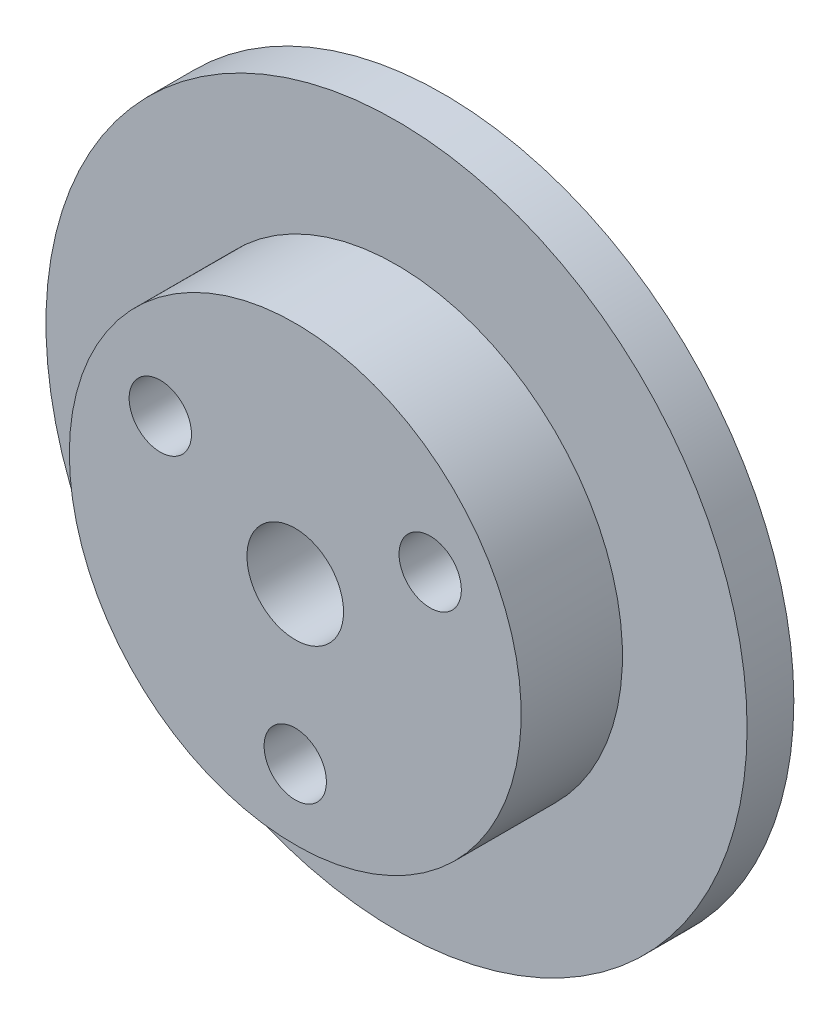
from build123d import *

# Parameters (mm, degrees)
ESQUISSE1_R             = 22.5
BOSS_EXTRU_1_DEPTH      = 3
ESQUISSE2_R             = 14.5
BOSS_EXTRU_2_DEPTH      = 6.5
ESQUISSE3_R             = 2
ESQUISSE3_R_2           = 3.1
ENL_V_MAT_EXTRU_1_DEPTH = 34.207679835


with BuildPart() as part:
    # Esquisse1 → Boss.-Extru.1 (new body)
    with BuildSketch(Plane.XY):
        Circle(ESQUISSE1_R)
    extrude(amount=BOSS_EXTRU_1_DEPTH)

    # Esquisse2 → Boss.-Extru.2 (add)
    with BuildSketch(Plane.XY.offset(3)):
        with Locations(Location((0, 0, 0), (0, 0, 180))):
            Circle(ESQUISSE2_R)
    extrude(amount=BOSS_EXTRU_2_DEPTH)

    # Esquisse3 → Enlèv. mat.-Extru.1 (cut, through all)
    with BuildSketch(Plane.XY.offset(9.5)):
        with Locations((8.660254038, 5)):
            Circle(ESQUISSE3_R)
        with Locations((-8.660254038, 5)):
            Circle(ESQUISSE3_R)
        with Locations((0, -10)):
            Circle(ESQUISSE3_R)
        Circle(ESQUISSE3_R_2)
    extrude(amount=-ENL_V_MAT_EXTRU_1_DEPTH, mode=Mode.SUBTRACT)


solid = part.part
